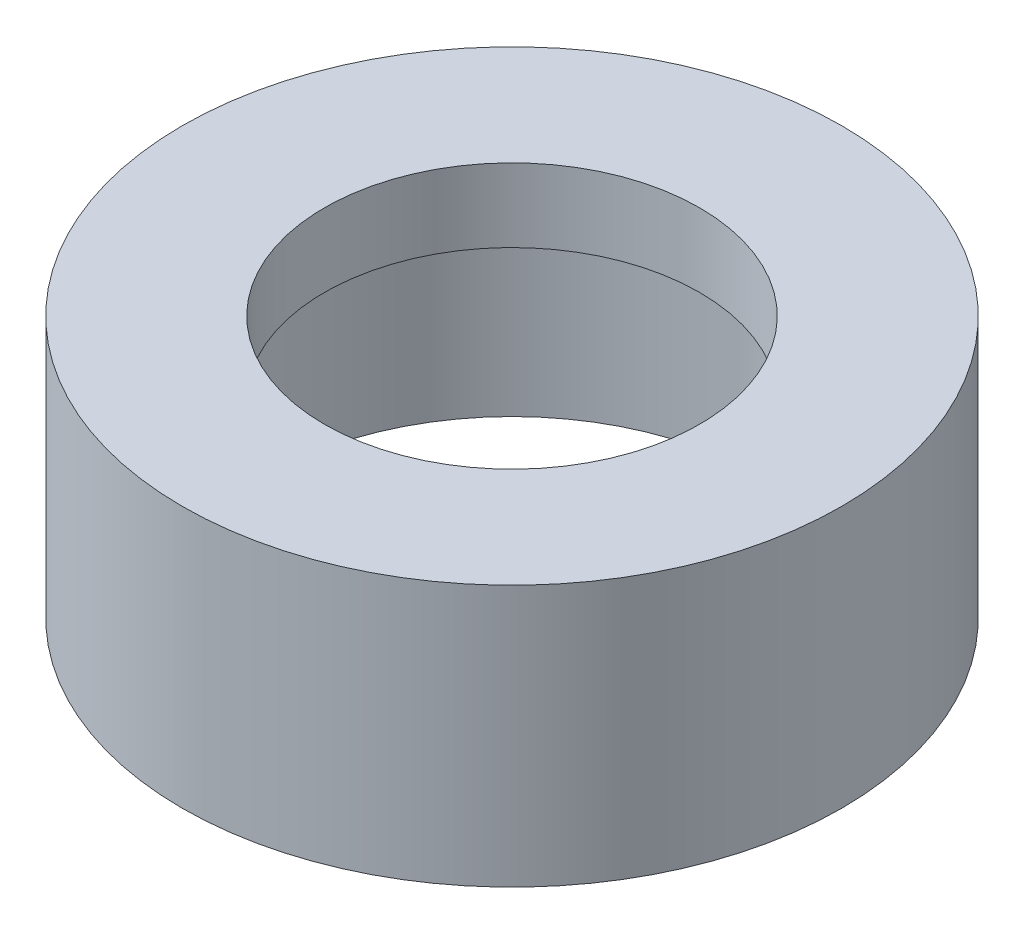
from build123d import *

# Parameters (mm, degrees)
SKETCH2_R          = 29
EXTRUDE1_DEPTH     = 23
SKETCH3_R          = 21.7
CUT_EXTRUDE1_DEPTH = 16.55
SKETCH4_R          = 16.5
CUT_EXTRUDE2_DEPTH = 48.021271782
CUT_EXTRUDE3_START = -3
SKETCH5_R          = 1.5
CUT_EXTRUDE3_DEPTH = 45.021271782


with BuildPart() as part:
    # Sketch2 → Extrude1 (new body)
    with BuildSketch(Plane(origin=(0, 0, 0), x_dir=(1, 0, 0), z_dir=(0, 1, 0))):
        with Locations(Location((0, 0, 0), (0, 0, 270))):
            Circle(SKETCH2_R)
    extrude(amount=EXTRUDE1_DEPTH)

    # Sketch3 → Cut-Extrude1 (cut)
    with BuildSketch(Plane.XZ):
        with Locations(Location((0, 0, 0), (0, 0, 270))):
            Circle(SKETCH3_R)
    extrude(amount=-CUT_EXTRUDE1_DEPTH, mode=Mode.SUBTRACT)

    # Sketch4 → Cut-Extrude2 (cut, through all)
    with BuildSketch(Plane(origin=(0, 23, 0), x_dir=(1, 0, 0), z_dir=(0, 1, 0))):
        with Locations(Location((0, 0, 0), (0, 0, 270))):
            Circle(SKETCH4_R)
    extrude(amount=-CUT_EXTRUDE2_DEPTH, mode=Mode.SUBTRACT)

    # Sketch5 → Cut-Extrude3 (cut, through all)
    with BuildSketch(Plane(origin=(0, 23, 0), x_dir=(1, 0, 0), z_dir=(0, 1, 0)).offset(CUT_EXTRUDE3_START)):
        with Locations(Location((0, 25.230472928, 0), (0, 0, 270))):
            Circle(SKETCH5_R)
        with Locations(Location((21.850230505, 12.615236464, 0), (0, 0, 270))):
            Circle(SKETCH5_R)
        with Locations(Location((21.850230505, -12.615236464, 0), (0, 0, 270))):
            Circle(SKETCH5_R)
        with Locations(Location((0, -25.230472928, 0), (0, 0, 270))):
            Circle(SKETCH5_R)
        with Locations(Location((-21.850230505, -12.615236464, 0), (0, 0, 270))):
            Circle(SKETCH5_R)
        with Locations(Location((-21.850230505, 12.615236464, 0), (0, 0, 270))):
            Circle(SKETCH5_R)
    extrude(amount=-CUT_EXTRUDE3_DEPTH, mode=Mode.SUBTRACT)


solid = part.part
